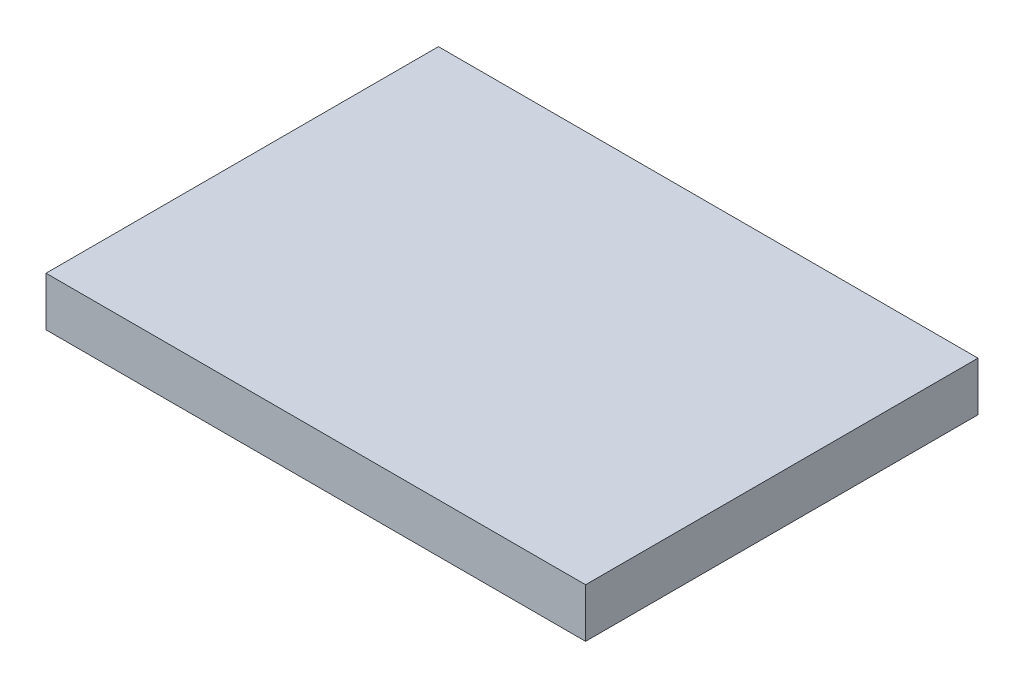
from build123d import *

# Parameters (mm, degrees)
SKETCH1_W           = 34.925
SKETCH1_H           = 25.4
BOSS_EXTRUDE1_DEPTH = 3.175


with BuildPart() as part:
    # Sketch1 → Boss-Extrude1 (new body)
    with BuildSketch(Plane(origin=(0, 0, 0), x_dir=(1, 0, 0), z_dir=(0, 1, 0))):
        with Locations((17.4625, 12.7)):
            Rectangle(SKETCH1_W, SKETCH1_H)
    extrude(amount=BOSS_EXTRUDE1_DEPTH)


solid = part.part
